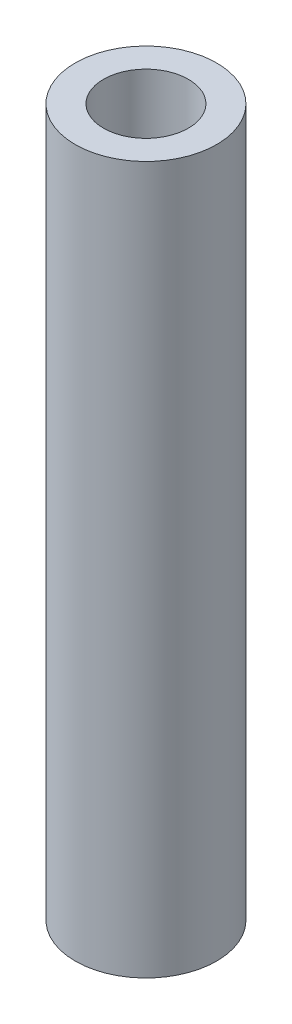
from build123d import *

# Parameters (mm, degrees)
SKETCH1_R           = 5
SKETCH1_R_2         = 3
BOSS_EXTRUDE1_DEPTH = 50


with BuildPart() as part:
    # Sketch1 → Boss-Extrude1 (new body)
    with BuildSketch(Plane(origin=(0, 0, 0), x_dir=(1, 0, 0), z_dir=(0, 1, 0))):
        with Locations(Location((0, 0, 0), (0, 0, 270))):
            Circle(SKETCH1_R)
        with Locations(Location((0, 0, 0), (0, 0, 270))):
            Circle(SKETCH1_R_2, mode=Mode.SUBTRACT)
    extrude(amount=BOSS_EXTRUDE1_DEPTH)


solid = part.part
